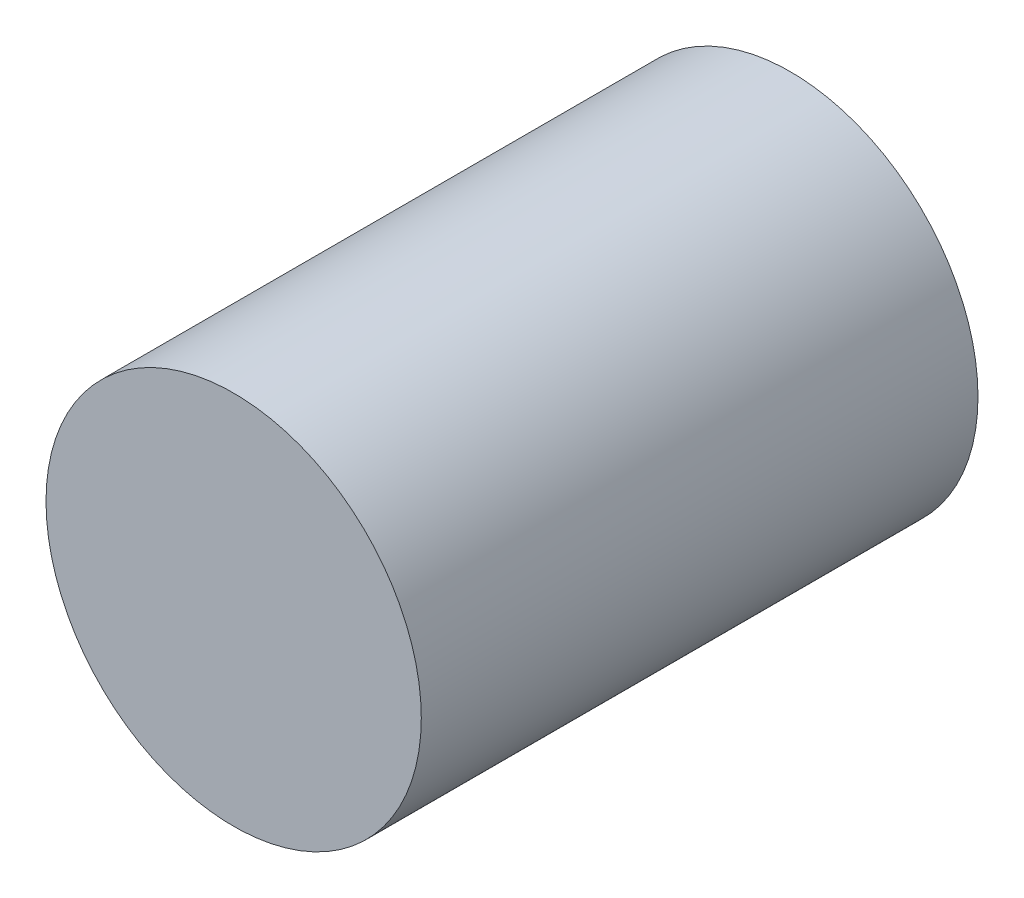
from build123d import *

# Parameters (mm, degrees)
SKETCH1_R           = 60
BOSS_EXTRUDE1_DEPTH = 178


with BuildPart() as part:
    # Sketch1 → Boss-Extrude1 (new body)
    with BuildSketch(Plane.XY):
        Circle(SKETCH1_R)
    extrude(amount=-BOSS_EXTRUDE1_DEPTH)


solid = part.part
